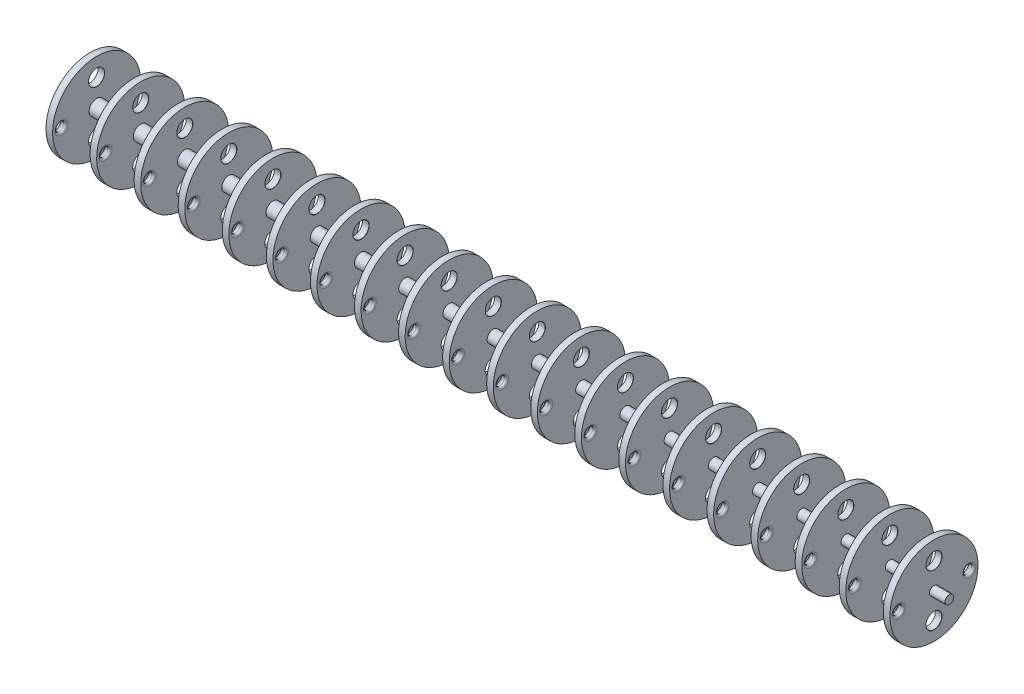
from build123d import *

# Parameters (mm, degrees)
SKETCH3_W                     = 1.5
SKETCH3_H                     = 10
CUT_EXTRUDE1_REACH            = 196.016
SKETCH5_R                     = 1
FILLET1_R                     = 0.5
M3_CLEARANCE_HOLE1_AT_2_COUNT = 2
M3_CLEARANCE_HOLE1_AT_2_PITCH = 11.753671306
LPATTERN1_COUNT               = 20
LPATTERN1_PITCH               = 10
FILLET1_OF_LPATTERN1_R        = 0.5


with BuildPart() as part:
    # Sketch2 → Revolve1 (revolve)
    with BuildSketch(Plane.XY):
        Polygon((0, 1.75), (200, 1), (200, 0), (0, 0), align=None)
    revolve(axis=Axis((200, 0, 0), (-1, 0, 0)))

    # Sketch3 → Revolve2 (revolve)
    with BuildSketch(Plane.XY):
        with Locations((5.75, 5)):
            Rectangle(SKETCH3_W, SKETCH3_H)
    revolve2 = revolve(axis=Axis((6.5, 0, 0), (-1, 0, 0)))

    # Sketch5 → Cut-Extrude1 (cut, up to next)
    with BuildSketch(Plane(origin=(6.5, 0, 0), x_dir=(0, 0, -1), z_dir=(1, 0, 0)), mode=Mode.PRIVATE) as cut_extrude1_sk1:
        with Locations(Location((-8, 0, 0), (0, 0, 90))):
            Circle(SKETCH5_R)
    cut_extrude1_tool1 = extrude(cut_extrude1_sk1.sketch, amount=-CUT_EXTRUDE1_REACH, mode=Mode.PRIVATE) & part.part
    # Sketch5 → Cut-Extrude1 (cut, up to next)
    with BuildSketch(Plane(origin=(6.5, 0, 0), x_dir=(0, 0, -1), z_dir=(1, 0, 0)), mode=Mode.PRIVATE) as cut_extrude1_sk2:
        with Locations(Location((8, 0, 0), (0, 0, 90))):
            Circle(SKETCH5_R)
    cut_extrude1_tool2 = extrude(cut_extrude1_sk2.sketch, amount=-CUT_EXTRUDE1_REACH, mode=Mode.PRIVATE) & part.part
    cut_extrude1_1 = cut_extrude1_tool1.solids().sort_by_distance((6.5, 0, 8))[0]
    add(cut_extrude1_1, mode=Mode.SUBTRACT)
    cut_extrude1_2 = cut_extrude1_tool2.solids().sort_by_distance((6.5, 0, -8))[0]
    add(cut_extrude1_2, mode=Mode.SUBTRACT)
    cut_extrude1 = cut_extrude1_1 + cut_extrude1_2  # Cut-Extrude1 as one shape, for the pattern or mirror that repeats it

    # Fillet1
    fillet1_edges = [part.edges().sort_by_distance(p)[0] for p in [
        (5, -1, 8),
        (6.5, -1, 8),
        (5, -1, -8),
        (6.5, -1, -8),
    ]]
    fillet(fillet1_edges, radius=FILLET1_R)

    # Sketch15 → M3 Clearance Hole1 (revolve, cut)
    with BuildSketch(Plane(origin=(6.5, -5.890858806, 0), x_dir=(0, 0, -1), z_dir=(0, 1, 0))):
        Polygon((0, 0), (0, 1.5), (1.8, 1.5), (1.8, 0.025), (1.825, 0), align=None)
    m3_clearance_hole1 = revolve(axis=Axis((12.85, -5.890858806, 0), (-1, 0, 0)), mode=Mode.SUBTRACT)

    # M3 Clearance Hole1 at 2: M3 Clearance Hole1 ×2
    with Locations(*[(0, i * M3_CLEARANCE_HOLE1_AT_2_PITCH, 0) for i in range(1, M3_CLEARANCE_HOLE1_AT_2_COUNT)]):
        add(m3_clearance_hole1, mode=Mode.SUBTRACT)

    # LPattern1: Revolve2, Cut-Extrude1, M3 Clearance Hole1 ×20
    with Locations(*[(i * LPATTERN1_PITCH, 0, 0) for i in range(1, LPATTERN1_COUNT)]):
        add(revolve2)
        add(cut_extrude1, mode=Mode.SUBTRACT)
        add(m3_clearance_hole1, mode=Mode.SUBTRACT)

    # LPattern1 copy 1 sketch → LPattern1 copy 1 (revolve, cut)
    with BuildSketch(Plane(origin=(16.5, 5.8628125, 0), x_dir=(0, 0, -1), z_dir=(0, 1, 0))):
        Polygon((0, 0), (0, 1.5), (1.8, 1.5), (1.8, 0.025), (1.825, 0), align=None)
    revolve(axis=Axis((22.85, 5.8628125, 0), (-1, 0, 0)), mode=Mode.SUBTRACT)

    # LPattern1 copy 2 sketch → LPattern1 copy 2 (revolve, cut)
    with BuildSketch(Plane(origin=(26.5, 5.8628125, 0), x_dir=(0, 0, -1), z_dir=(0, 1, 0))):
        Polygon((0, 0), (0, 1.5), (1.8, 1.5), (1.8, 0.025), (1.825, 0), align=None)
    revolve(axis=Axis((32.85, 5.8628125, 0), (-1, 0, 0)), mode=Mode.SUBTRACT)

    # LPattern1 copy 3 sketch → LPattern1 copy 3 (revolve, cut)
    with BuildSketch(Plane(origin=(36.5, 5.8628125, 0), x_dir=(0, 0, -1), z_dir=(0, 1, 0))):
        Polygon((0, 0), (0, 1.5), (1.8, 1.5), (1.8, 0.025), (1.825, 0), align=None)
    revolve(axis=Axis((42.85, 5.8628125, 0), (-1, 0, 0)), mode=Mode.SUBTRACT)

    # LPattern1 copy 4 sketch → LPattern1 copy 4 (revolve, cut)
    with BuildSketch(Plane(origin=(46.5, 5.8628125, 0), x_dir=(0, 0, -1), z_dir=(0, 1, 0))):
        Polygon((0, 0), (0, 1.5), (1.8, 1.5), (1.8, 0.025), (1.825, 0), align=None)
    revolve(axis=Axis((52.85, 5.8628125, 0), (-1, 0, 0)), mode=Mode.SUBTRACT)

    # LPattern1 copy 5 sketch → LPattern1 copy 5 (revolve, cut)
    with BuildSketch(Plane(origin=(56.5, 5.8628125, 0), x_dir=(0, 0, -1), z_dir=(0, 1, 0))):
        Polygon((0, 0), (0, 1.5), (1.8, 1.5), (1.8, 0.025), (1.825, 0), align=None)
    revolve(axis=Axis((62.85, 5.8628125, 0), (-1, 0, 0)), mode=Mode.SUBTRACT)

    # LPattern1 copy 6 sketch → LPattern1 copy 6 (revolve, cut)
    with BuildSketch(Plane(origin=(66.5, 5.8628125, 0), x_dir=(0, 0, -1), z_dir=(0, 1, 0))):
        Polygon((0, 0), (0, 1.5), (1.8, 1.5), (1.8, 0.025), (1.825, 0), align=None)
    revolve(axis=Axis((72.85, 5.8628125, 0), (-1, 0, 0)), mode=Mode.SUBTRACT)

    # LPattern1 copy 7 sketch → LPattern1 copy 7 (revolve, cut)
    with BuildSketch(Plane(origin=(76.5, 5.8628125, 0), x_dir=(0, 0, -1), z_dir=(0, 1, 0))):
        Polygon((0, 0), (0, 1.5), (1.8, 1.5), (1.8, 0.025), (1.825, 0), align=None)
    revolve(axis=Axis((82.85, 5.8628125, 0), (-1, 0, 0)), mode=Mode.SUBTRACT)

    # LPattern1 copy 8 sketch → LPattern1 copy 8 (revolve, cut)
    with BuildSketch(Plane(origin=(86.5, 5.8628125, 0), x_dir=(0, 0, -1), z_dir=(0, 1, 0))):
        Polygon((0, 0), (0, 1.5), (1.8, 1.5), (1.8, 0.025), (1.825, 0), align=None)
    revolve(axis=Axis((92.85, 5.8628125, 0), (-1, 0, 0)), mode=Mode.SUBTRACT)

    # LPattern1 copy 9 sketch → LPattern1 copy 9 (revolve, cut)
    with BuildSketch(Plane(origin=(96.5, 5.8628125, 0), x_dir=(0, 0, -1), z_dir=(0, 1, 0))):
        Polygon((0, 0), (0, 1.5), (1.8, 1.5), (1.8, 0.025), (1.825, 0), align=None)
    revolve(axis=Axis((102.85, 5.8628125, 0), (-1, 0, 0)), mode=Mode.SUBTRACT)

    # LPattern1 copy 10 sketch → LPattern1 copy 10 (revolve, cut)
    with BuildSketch(Plane(origin=(106.5, 5.8628125, 0), x_dir=(0, 0, -1), z_dir=(0, 1, 0))):
        Polygon((0, 0), (0, 1.5), (1.8, 1.5), (1.8, 0.025), (1.825, 0), align=None)
    revolve(axis=Axis((112.85, 5.8628125, 0), (-1, 0, 0)), mode=Mode.SUBTRACT)

    # LPattern1 copy 11 sketch → LPattern1 copy 11 (revolve, cut)
    with BuildSketch(Plane(origin=(116.5, 5.8628125, 0), x_dir=(0, 0, -1), z_dir=(0, 1, 0))):
        Polygon((0, 0), (0, 1.5), (1.8, 1.5), (1.8, 0.025), (1.825, 0), align=None)
    revolve(axis=Axis((122.85, 5.8628125, 0), (-1, 0, 0)), mode=Mode.SUBTRACT)

    # LPattern1 copy 12 sketch → LPattern1 copy 12 (revolve, cut)
    with BuildSketch(Plane(origin=(126.5, 5.8628125, 0), x_dir=(0, 0, -1), z_dir=(0, 1, 0))):
        Polygon((0, 0), (0, 1.5), (1.8, 1.5), (1.8, 0.025), (1.825, 0), align=None)
    revolve(axis=Axis((132.85, 5.8628125, 0), (-1, 0, 0)), mode=Mode.SUBTRACT)

    # LPattern1 copy 13 sketch → LPattern1 copy 13 (revolve, cut)
    with BuildSketch(Plane(origin=(136.5, 5.8628125, 0), x_dir=(0, 0, -1), z_dir=(0, 1, 0))):
        Polygon((0, 0), (0, 1.5), (1.8, 1.5), (1.8, 0.025), (1.825, 0), align=None)
    revolve(axis=Axis((142.85, 5.8628125, 0), (-1, 0, 0)), mode=Mode.SUBTRACT)

    # LPattern1 copy 14 sketch → LPattern1 copy 14 (revolve, cut)
    with BuildSketch(Plane(origin=(146.5, 5.8628125, 0), x_dir=(0, 0, -1), z_dir=(0, 1, 0))):
        Polygon((0, 0), (0, 1.5), (1.8, 1.5), (1.8, 0.025), (1.825, 0), align=None)
    revolve(axis=Axis((152.85, 5.8628125, 0), (-1, 0, 0)), mode=Mode.SUBTRACT)

    # LPattern1 copy 15 sketch → LPattern1 copy 15 (revolve, cut)
    with BuildSketch(Plane(origin=(156.5, 5.8628125, 0), x_dir=(0, 0, -1), z_dir=(0, 1, 0))):
        Polygon((0, 0), (0, 1.5), (1.8, 1.5), (1.8, 0.025), (1.825, 0), align=None)
    revolve(axis=Axis((162.85, 5.8628125, 0), (-1, 0, 0)), mode=Mode.SUBTRACT)

    # LPattern1 copy 16 sketch → LPattern1 copy 16 (revolve, cut)
    with BuildSketch(Plane(origin=(166.5, 5.8628125, 0), x_dir=(0, 0, -1), z_dir=(0, 1, 0))):
        Polygon((0, 0), (0, 1.5), (1.8, 1.5), (1.8, 0.025), (1.825, 0), align=None)
    revolve(axis=Axis((172.85, 5.8628125, 0), (-1, 0, 0)), mode=Mode.SUBTRACT)

    # LPattern1 copy 17 sketch → LPattern1 copy 17 (revolve, cut)
    with BuildSketch(Plane(origin=(176.5, 5.8628125, 0), x_dir=(0, 0, -1), z_dir=(0, 1, 0))):
        Polygon((0, 0), (0, 1.5), (1.8, 1.5), (1.8, 0.025), (1.825, 0), align=None)
    revolve(axis=Axis((182.85, 5.8628125, 0), (-1, 0, 0)), mode=Mode.SUBTRACT)

    # LPattern1 copy 18 sketch → LPattern1 copy 18 (revolve, cut)
    with BuildSketch(Plane(origin=(186.5, 5.8628125, 0), x_dir=(0, 0, -1), z_dir=(0, 1, 0))):
        Polygon((0, 0), (0, 1.5), (1.8, 1.5), (1.8, 0.025), (1.825, 0), align=None)
    revolve(axis=Axis((192.85, 5.8628125, 0), (-1, 0, 0)), mode=Mode.SUBTRACT)

    # LPattern1 copy 19 sketch → LPattern1 copy 19 (revolve, cut)
    with BuildSketch(Plane(origin=(196.5, 5.8628125, 0), x_dir=(0, 0, -1), z_dir=(0, 1, 0))):
        Polygon((0, 0), (0, 1.5), (1.8, 1.5), (1.8, 0.025), (1.825, 0), align=None)
    revolve(axis=Axis((202.85, 5.8628125, 0), (-1, 0, 0)), mode=Mode.SUBTRACT)

    # Fillet1 of LPattern1
    fillet1_of_lpattern1_edges = [part.edges().sort_by_distance(p)[0] for p in [
        (15, -1, 8),
        (16.5, -1, 8),
        (15, -1, -8),
        (16.5, -1, -8),
        (25, -1, 8),
        (26.5, -1, 8),
        (25, -1, -8),
        (26.5, -1, -8),
        (35, -1, 8),
        (36.5, -1, 8),
        (35, -1, -8),
        (36.5, -1, -8),
        (45, -1, 8),
        (46.5, -1, 8),
        (45, -1, -8),
        (46.5, -1, -8),
        (55, -1, 8),
        (56.5, -1, 8),
        (55, -1, -8),
        (56.5, -1, -8),
        (65, -1, 8),
        (66.5, -1, 8),
        (65, -1, -8),
        (66.5, -1, -8),
        (75, -1, 8),
        (76.5, -1, 8),
        (75, -1, -8),
        (76.5, -1, -8),
        (85, -1, 8),
        (86.5, -1, 8),
        (85, -1, -8),
        (86.5, -1, -8),
        (95, -1, 8),
        (96.5, -1, 8),
        (95, -1, -8),
        (96.5, -1, -8),
        (105, -1, 8),
        (106.5, -1, 8),
        (105, -1, -8),
        (106.5, -1, -8),
        (115, -1, 8),
        (116.5, -1, 8),
        (115, -1, -8),
        (116.5, -1, -8),
        (125, -1, 8),
        (126.5, -1, 8),
        (125, -1, -8),
        (126.5, -1, -8),
        (135, -1, 8),
        (136.5, -1, 8),
        (135, -1, -8),
        (136.5, -1, -8),
        (145, -1, 8),
        (146.5, -1, 8),
        (145, -1, -8),
        (146.5, -1, -8),
        (155, -1, 8),
        (156.5, -1, 8),
        (155, -1, -8),
        (156.5, -1, -8),
        (165, -1, 8),
        (166.5, -1, 8),
        (165, -1, -8),
        (166.5, -1, -8),
        (175, -1, 8),
        (176.5, -1, 8),
        (175, -1, -8),
        (176.5, -1, -8),
        (185, -1, 8),
        (186.5, -1, 8),
        (185, -1, -8),
        (186.5, -1, -8),
        (195, -1, 8),
        (196.5, -1, 8),
        (195, -1, -8),
        (196.5, -1, -8),
    ]]
    fillet(fillet1_of_lpattern1_edges, radius=FILLET1_OF_LPATTERN1_R)


solid = part.part
